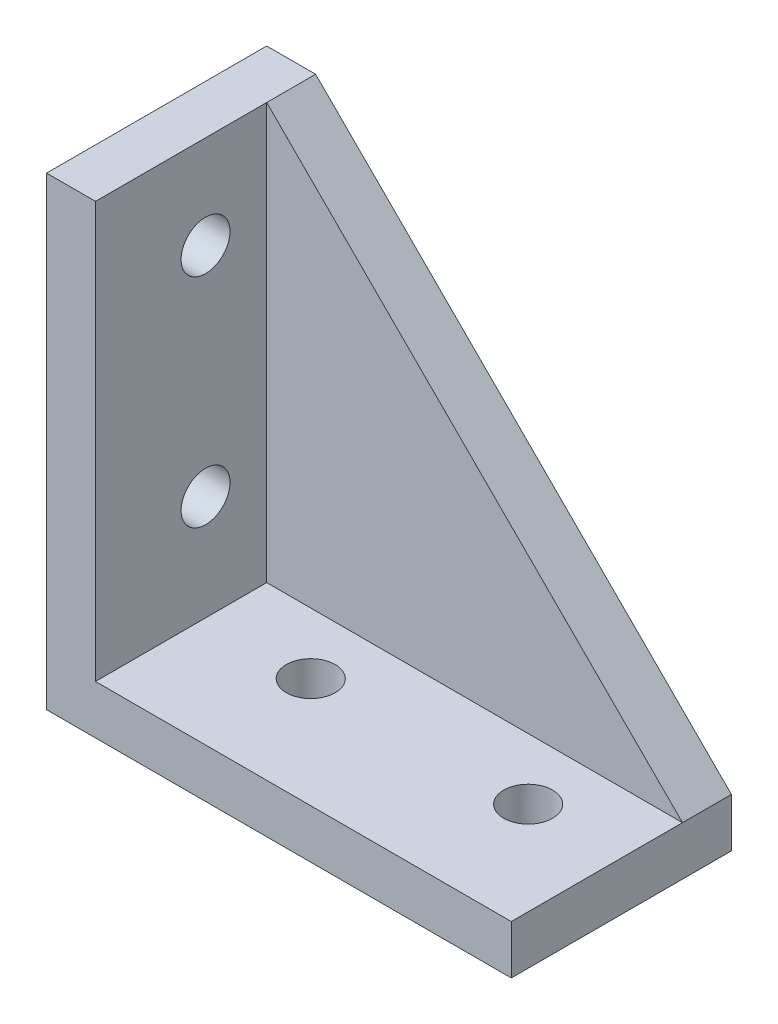
from build123d import *

# Parameters (mm, degrees)
BOSS_EXTRUDE1_DEPTH = 14
BOSS_EXTRUDE2_DEPTH = 4
SKETCH3_R           = 2
CUT_EXTRUDE1_DEPTH  = 4


with BuildPart() as part:
    # Sketch1 → Boss-Extrude1 (new body)
    with BuildSketch(Plane.XY):
        Polygon((0, 0), (0, 38), (4, 38), (4, 4), (38, 4), (38, 0), align=None)
    extrude(amount=BOSS_EXTRUDE1_DEPTH)

    # Sketch2 → Boss-Extrude2 (add)
    with BuildSketch(Plane(origin=(0, 0, 0), x_dir=(-1, 0, 0), z_dir=(0, 0, -1))):
        Polygon((-4, 38), (-38, 4), (-4, 4), align=None)
        Polygon((-38, 4), (-38, 0), (0, 0), (0, 38), (-4, 38), (-4, 4), align=None)
    extrude(amount=BOSS_EXTRUDE2_DEPTH)

    # Sketch3 → Cut-Extrude1 (cut)
    with BuildSketch(Plane(origin=(4, 0, 0), x_dir=(0, 0, -1), z_dir=(1, 0, 0))):
        with Locations(Location((-5, 30.38, 0), (0, 0, 90))):
            Circle(SKETCH3_R)
        with Locations(Location((-5, 12.6, 0), (0, 0, 90))):
            Circle(SKETCH3_R)
    cut_extrude1 = extrude(amount=-CUT_EXTRUDE1_DEPTH, mode=Mode.SUBTRACT)

    # Mirror4: Cut-Extrude1 across plane
    add(cut_extrude1.mirror(Plane(origin=(0, 0, 0), x_dir=(0, 0, 1), z_dir=(0.7071067811865438, -0.7071067811865512, 0))), mode=Mode.SUBTRACT)


solid = part.part
